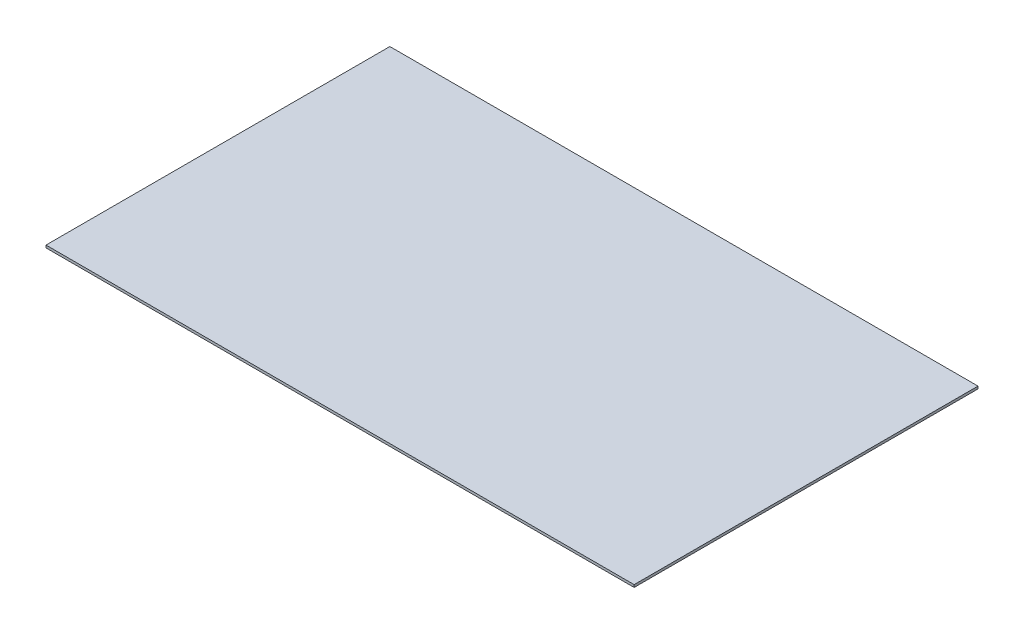
from build123d import *

# Parameters (mm, degrees)
SKETCH_1_W      = 2138
SKETCH_1_H      = 1250
EXTRUDE_1_DEPTH = 9


with BuildPart() as part:
    # Эскиз1 → Бобышка-Вытянуть1 (new body)
    with BuildSketch(Plane(origin=(0, 0, 0), x_dir=(1, 0, 0), z_dir=(0, 1, 0))):
        Rectangle(SKETCH_1_W, SKETCH_1_H)
    extrude(amount=EXTRUDE_1_DEPTH)


solid = part.part
